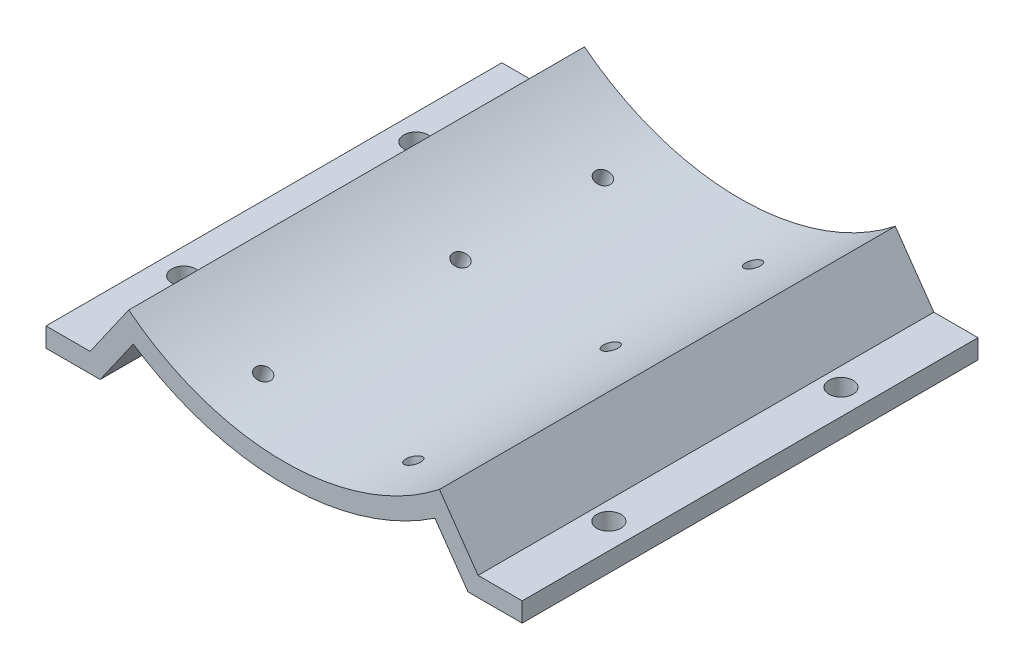
from build123d import *

# Parameters (mm, degrees)
BOSS_EXTRUDE1_DEPTH         = 149.606
SKETCH5_R                   = 2.54
CUT_EXTRUDE1_DEPTH          = 25.4
SKETCH4_R                   = 2.54
CUT_EXTRUDE2_DEPTH          = 25.4
TAP_DRILL_FOR_3_8_16_TAP1_D = 7.9375


with BuildPart() as part:
    # Sketch1 → Boss-Extrude1 (new body)
    with BuildSketch(Plane.XY):
        with BuildLine():
            Line((-63.668954771, 6.951268616), (-78.143354, 6.951268616))
            Line((-78.143354, 6.951268616), (-78.143354, 0.601268616))
            Line((-78.143354, 0.601268616), (-60.363354, 0.601268616))
            Line((-60.363354, 0.601268616), (-49.49782024, 16.118858997))
            ThreePointArc((-49.49782024, 16.118858997), (0, 1.06448034), (49.49782024, 16.118858997))
            Line((49.49782024, 16.118858997), (60.363354, 0.601268616))
            Line((60.363354, 0.601268616), (78.143354, 0.601268616))
            Line((78.143354, 0.601268616), (78.143354, 6.951268616))
            Line((78.143354, 6.951268616), (63.668954771, 6.951268616))
            Line((63.668954771, 6.951268616), (50.996127998, 25.049940912))
            ThreePointArc((50.996127998, 25.049940912), (0, 7.41448034), (-50.996127998, 25.049940912))
            Line((-50.996127998, 25.049940912), (-63.668954771, 6.951268616))
        make_face()
    extrude(amount=BOSS_EXTRUDE1_DEPTH)

    # Sketch5 → Cut-Extrude1 (cut)
    with BuildSketch(Plane(origin=(0.999392331, 3.192633299, 0), x_dir=(0.9543356688296087, -0.29873639081896847, 0), z_dir=(0.29873639081896847, 0.9543356688296087, 0))):
        with Locations((-26.875664159, -20.32)):
            Circle(SKETCH5_R)
        with Locations((-26.875664159, -67.056)):
            Circle(SKETCH5_R)
        with Locations((-26.875664159, -131.826)):
            Circle(SKETCH5_R)
    extrude(amount=-CUT_EXTRUDE1_DEPTH, mode=Mode.SUBTRACT)

    # Sketch4 → Cut-Extrude2 (cut)
    with BuildSketch(Plane(origin=(-0.999392331, 3.192633299, 0), x_dir=(-0.9543356688296079, -0.2987363908189716, 0), z_dir=(0.2987363908189716, -0.9543356688296079, 0))):
        with Locations((-26.875664159, -131.826)):
            Circle(SKETCH4_R)
        with Locations((-26.875664159, -67.056)):
            Circle(SKETCH4_R)
        with Locations((-26.875664159, -20.32)):
            Circle(SKETCH4_R)
    extrude(amount=CUT_EXTRUDE2_DEPTH, mode=Mode.SUBTRACT)

    # Tap Drill for 3/8-16 Tap1 (through all)
    with Locations(Plane(origin=(0, 6.951268616, 0), x_dir=(1, 0, 0), z_dir=(0, 1, 0))):
        with Locations((-69.761354, -112.776), (-69.761354, -36.576), (69.761354, -112.776), (69.761354, -36.576)):
            Hole(TAP_DRILL_FOR_3_8_16_TAP1_D / 2)


solid = part.part
